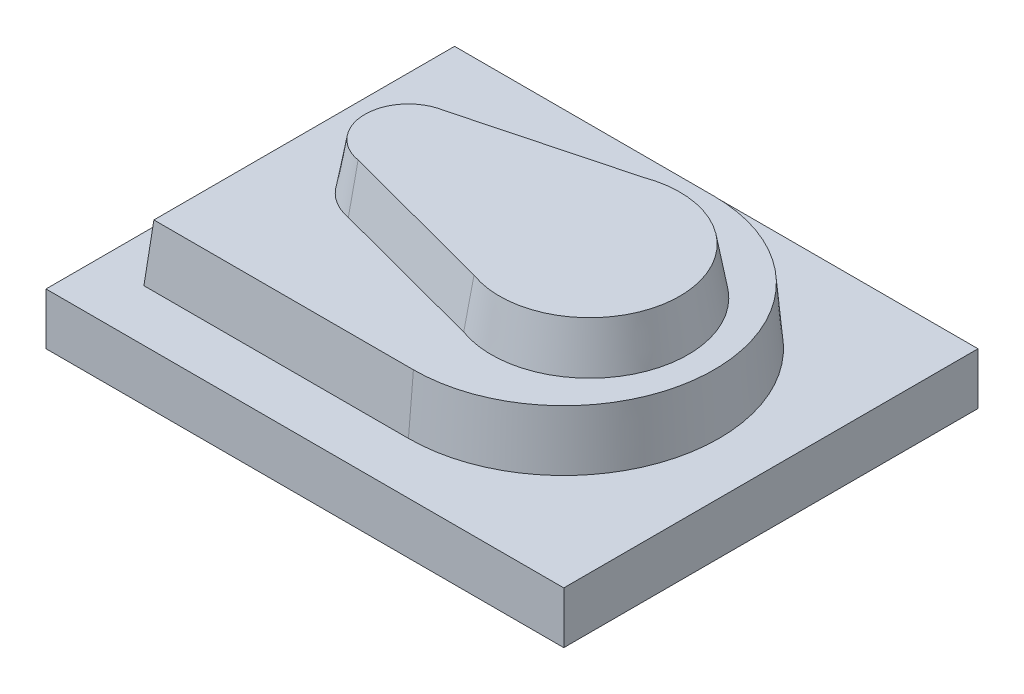
from build123d import *

# Parameters (mm, degrees)
SKETCH_1_W      = 100
SKETCH_1_H      = 80
EXTRUDE_1_DEPTH = 10
EXTRUDE_2_DEPTH = 11
EXTRUDE_2_TAPER = 5
EXTRUDE_3_DEPTH = 9
EXTRUDE_3_TAPER = 10


with BuildPart() as part:
    # 스케치1 → 보스-돌출1 (new body)
    with BuildSketch(Plane(origin=(0, 0, 0), x_dir=(1, 0, 0), z_dir=(0, 1, 0))):
        Rectangle(SKETCH_1_W, SKETCH_1_H)
    extrude(amount=EXTRUDE_1_DEPTH)

    # 스케치2 → 보스-돌출2 (add)
    with BuildSketch(Plane(origin=(0, 10, 0), x_dir=(1, 0, 0), z_dir=(0, 1, 0))):
        with BuildLine():
            Line((10, 30), (-41.089791126, 30))
            Line((-41.089791126, 30), (-41.089791126, -30))
            Line((-41.089791126, -30), (10, -30))
            ThreePointArc((10, -30), (40, 0), (10, 30))
        make_face()
    extrude(amount=EXTRUDE_2_DEPTH, taper=EXTRUDE_2_TAPER)

    # 스케치4 → 보스-돌출3 (add)
    with BuildSketch(Plane(origin=(0, 21, 0), x_dir=(1, 0, 0), z_dir=(0, 1, 0))):
        with BuildLine():
            ThreePointArc((-21.764734991, 9.843053917), (-29.999999933, 0.001156755), (-21.767012144, -9.84264538))
            Line((-21.767012144, -9.84264538), (8.542741709, -17.869074273))
            ThreePointArc((8.542741709, -17.869074273), (33.999996077, 0.012209678), (8.51978119, 17.860760459))
            Line((8.51978119, 17.860760459), (-21.764734991, 9.843053917))
        make_face()
    extrude(amount=EXTRUDE_3_DEPTH, taper=EXTRUDE_3_TAPER)


solid = part.part
